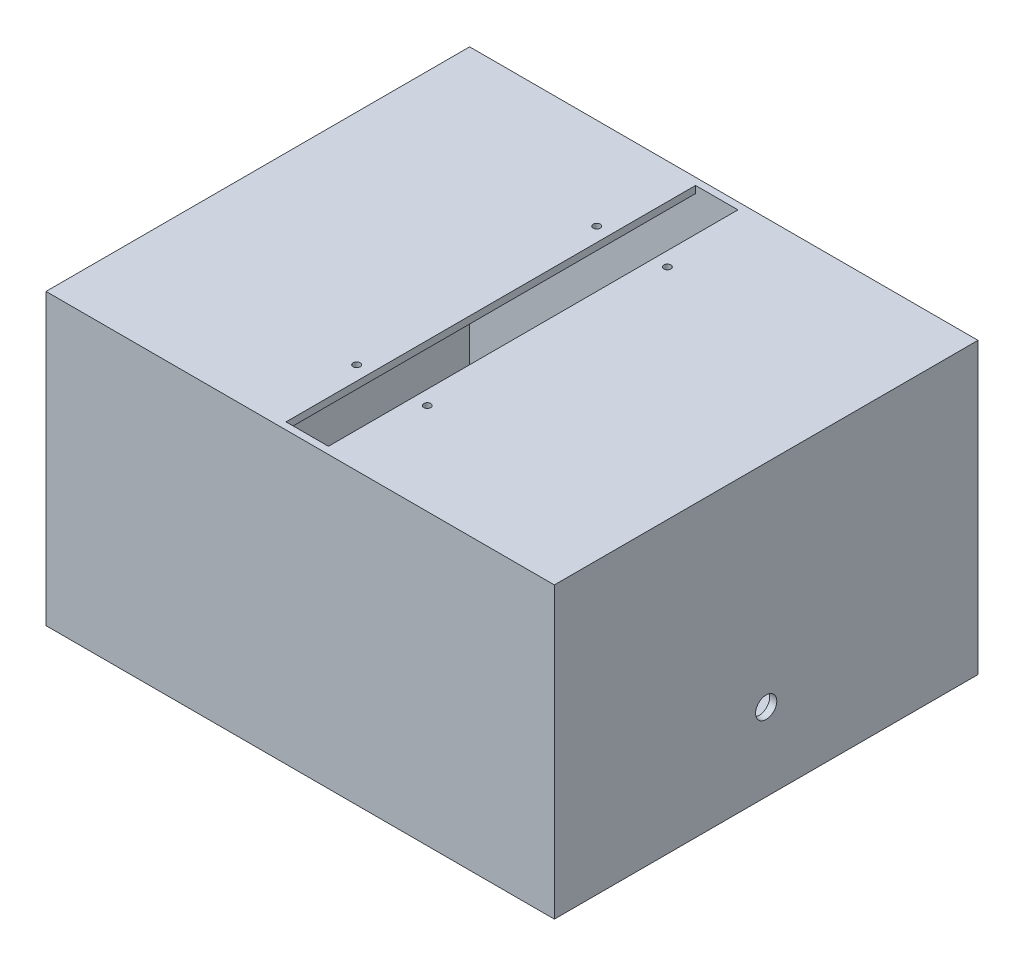
from build123d import *

# Parameters (mm, degrees)
SKETCH1_W           = 360
SKETCH1_H           = 300
BOSS_EXTRUDE1_DEPTH = 200
SKETCH2_W           = 350
SKETCH2_H           = 290
CUT_EXTRUDE1_DEPTH  = 195
SKETCH3_W           = 30
SKETCH3_H           = 290
CUT_EXTRUDE2_DEPTH  = 309.058436015
SKETCH4_R           = 7.5
CUT_EXTRUDE3_DEPTH  = 439.292140016
SKETCH5_R           = 2.5
CUT_EXTRUDE4_DEPTH  = 5
SKETCH6_W           = 360
SKETCH6_H           = 300
BOSS_EXTRUDE2_DEPTH = 5
SKETCH7_W           = 200
SKETCH7_H           = 27
CUT_EXTRUDE5_DEPTH  = 5


with BuildPart() as part:
    # Sketch1 → Boss-Extrude1 (new body)
    with BuildSketch(Plane(origin=(0, 0, 0), x_dir=(1, 0, 0), z_dir=(0, 1, 0))):
        Rectangle(SKETCH1_W, SKETCH1_H)
    extrude(amount=-BOSS_EXTRUDE1_DEPTH)

    # Sketch2 → Cut-Extrude1 (cut)
    with BuildSketch(Plane.XZ.offset(200)):
        Rectangle(SKETCH2_W, SKETCH2_H)
    extrude(amount=-CUT_EXTRUDE1_DEPTH, mode=Mode.SUBTRACT)

    # Sketch3 → Cut-Extrude2 (cut, through all)
    with BuildSketch(Plane(origin=(0, 0, 0), x_dir=(1, 0, 0), z_dir=(0, 1, 0))):
        Rectangle(SKETCH3_W, SKETCH3_H)
    extrude(amount=-CUT_EXTRUDE2_DEPTH, mode=Mode.SUBTRACT)

    # Sketch4 → Cut-Extrude3 (cut, through all)
    with BuildSketch(Plane.ZY.offset(180)):
        with Locations((0, -150)):
            Circle(SKETCH4_R)
    extrude(amount=-CUT_EXTRUDE3_DEPTH, mode=Mode.SUBTRACT)

    # Sketch5 → Cut-Extrude4 (cut)
    with BuildSketch(Plane(origin=(0, 0, 0), x_dir=(1, 0, 0), z_dir=(0, 1, 0))):
        with Locations(Location((-25, 85, 0), (0, 0, 270))):
            Circle(SKETCH5_R)
        with Locations(Location((25, 85, 0), (0, 0, 270))):
            Circle(SKETCH5_R)
        with Locations(Location((25, -85, 0), (0, 0, 270))):
            Circle(SKETCH5_R)
        with Locations(Location((-25, -85, 0), (0, 0, 270))):
            Circle(SKETCH5_R)
    extrude(amount=-CUT_EXTRUDE4_DEPTH, mode=Mode.SUBTRACT)

    # Sketch6 → Boss-Extrude2 (add)
    with BuildSketch(Plane.XZ.offset(200)):
        Rectangle(SKETCH6_W, SKETCH6_H)
    extrude(amount=BOSS_EXTRUDE2_DEPTH)

    # Sketch7 → Cut-Extrude5 (cut)
    with BuildSketch(Plane(origin=(0, 0, -150), x_dir=(-1, 0, 0), z_dir=(0, 0, -1))):
        with Locations((0, -186.5)):
            Rectangle(SKETCH7_W, SKETCH7_H)
    extrude(amount=-CUT_EXTRUDE5_DEPTH, mode=Mode.SUBTRACT)


solid = part.part
